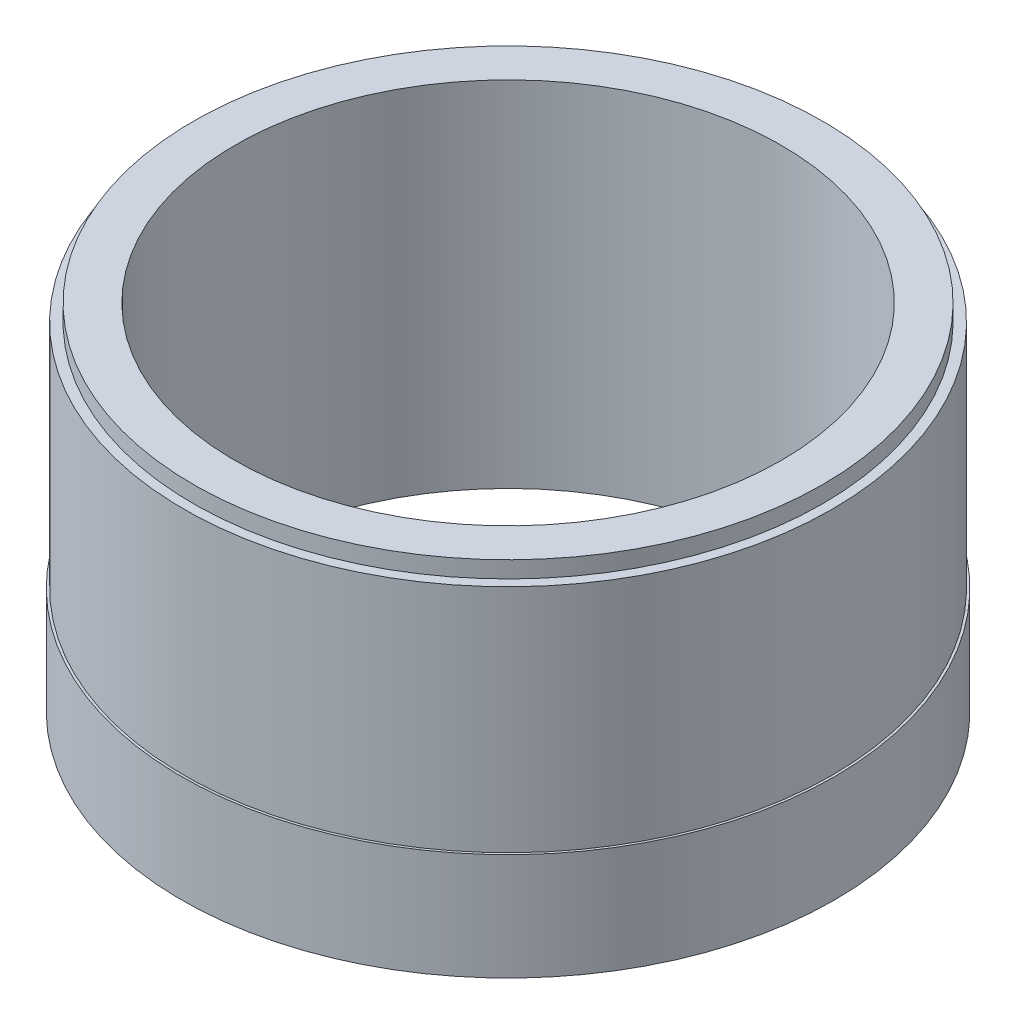
from build123d import *


with BuildPart() as part:
    # 草圖1 → 旋轉1 (revolve)
    with BuildSketch(Plane.XY):
        Polygon((136.5, 50), (136.5, 147), (132.5, 147), (132.5, 154), (115, 154), (115, 5), (137.5, 5), (137.5, 50), align=None)
    revolve(axis=Axis((0, 154, 0), (0, -1, 0)))


solid = part.part
